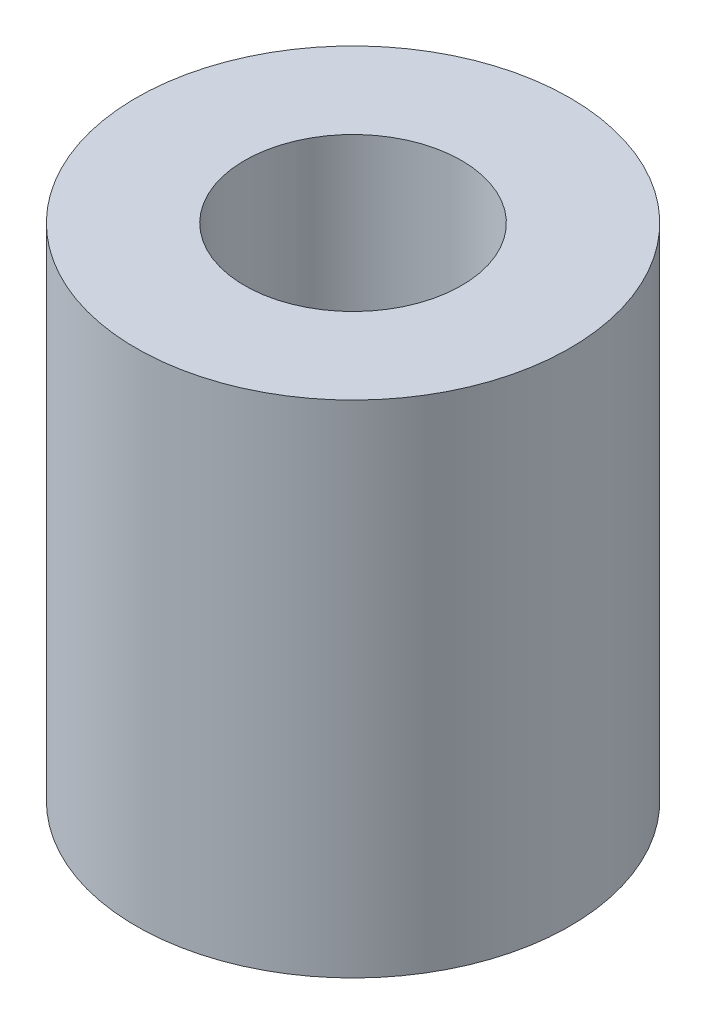
from build123d import *

# Parameters (mm, degrees)
SKETCH1_R           = 6.604
SKETCH1_R_2         = 3.302
BOSS_EXTRUDE1_DEPTH = 15.24


with BuildPart() as part:
    # Sketch1 → Boss-Extrude1 (new body)
    with BuildSketch(Plane(origin=(0, 0, 0), x_dir=(1, 0, 0), z_dir=(0, 1, 0))):
        with Locations(Location((0, 0, 0), (0, 0, 90))):
            Circle(SKETCH1_R)
        with Locations(Location((0, 0, 0), (0, 0, 90))):
            Circle(SKETCH1_R_2, mode=Mode.SUBTRACT)
    extrude(amount=BOSS_EXTRUDE1_DEPTH)


solid = part.part
